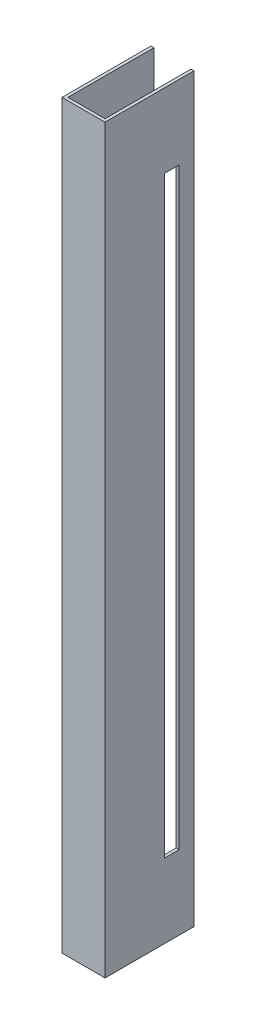
from build123d import *

# Parameters (mm, degrees)
BOSS_EXTRUDE1_DEPTH     = 500
CUT_EXTRUDE1_DEPTH      = 503.06174919
CUT_EXTRUDE1_DEPTH_BACK = 503.06174919
SKETCH2_W               = 10
SKETCH2_H               = 400


with BuildPart() as part:
    # Sketch1 → Boss-Extrude1 (new body)
    with BuildSketch(Plane(origin=(0, 0, 0), x_dir=(1, 0, 0), z_dir=(0, 1, 0))):
        Polygon((-25, -33), (-25, 25), (-27, 25), (-27, -35), (2, -35), (2, 25), (0, 25), (0, -33), align=None)
    extrude(amount=BOSS_EXTRUDE1_DEPTH)

    # Sketch2 → Cut-Extrude1 (cut, two sides: drawn at the far end of the back side and taken through both)
    with BuildSketch(Plane(origin=(2, 0, 0), x_dir=(0, 0, -1), z_dir=(1, 0, 0)).offset(-CUT_EXTRUDE1_DEPTH_BACK)):
        with Locations((10, 250)):
            Rectangle(SKETCH2_W, SKETCH2_H)
    extrude(amount=CUT_EXTRUDE1_DEPTH + CUT_EXTRUDE1_DEPTH_BACK, mode=Mode.SUBTRACT)


solid = part.part
